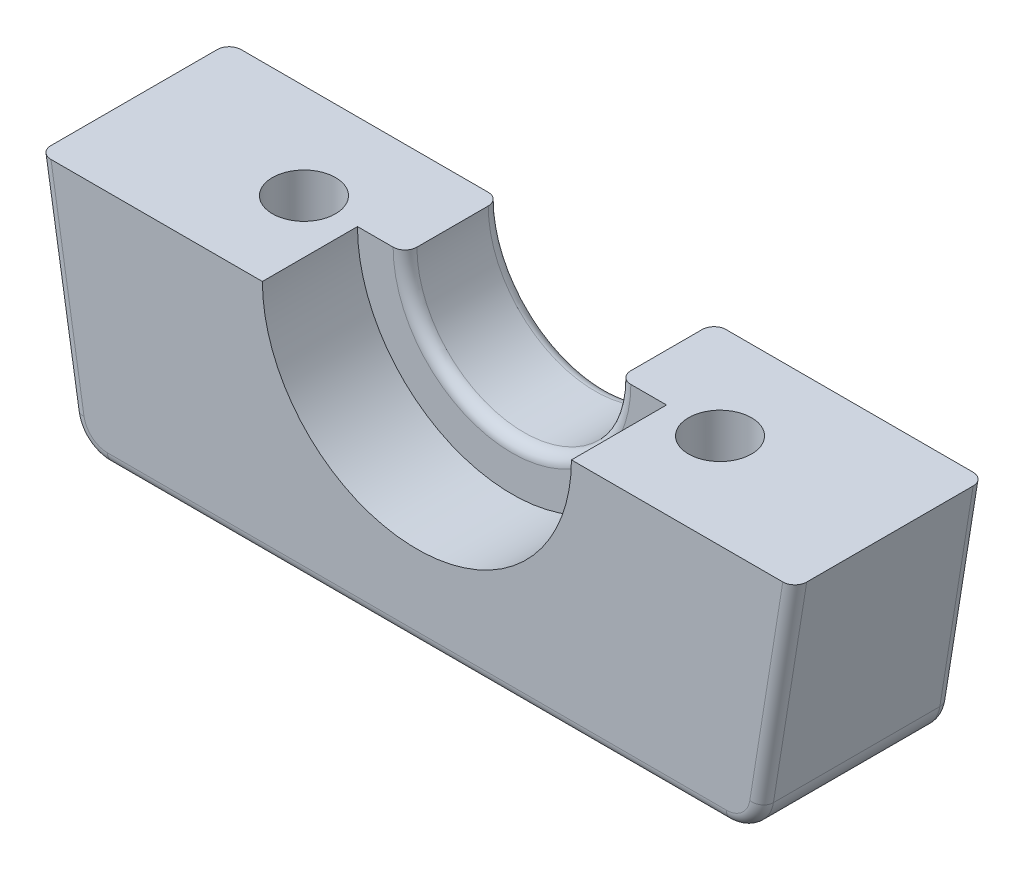
from build123d import *

# Parameters (mm, degrees)
DODANIE_WYCI_GNI_CIE1_DEPTH                       = 8
WYTNIJ_WYCI_GNI_CIE1_DEPTH                        = 8
WYTNIJ_WYCI_GNI_CIE2_DEPTH                        = 39.404607438
WYTNIJ_WYCI_GNI_CIE2_DEPTH_BACK                   = 39.404607438
POG_BIENIE_WALCOWE_POD_M5_RUB_Z_BEM_W_D           = 5.3
POG_BIENIE_WALCOWE_POD_M5_RUB_Z_BEM_W_CBORE_D     = 10
POG_BIENIE_WALCOWE_POD_M5_RUB_Z_BEM_W_CBORE_DEPTH = 5
ZAOKR_GLENIE1_R                                   = 3
ZAOKR_GLENIE2_R                                   = 1


with BuildPart() as part:
    # Szkic1 → Dodanie-wyciągnięcie1 (new, symmetric)
    with BuildSketch(Plane.XY):
        Polygon((0, 0), (28.58974359, 0), (31.794871795, 20), (0, 20), align=None)
    dodanie_wyci_gni_cie1 = extrude(amount=DODANIE_WYCI_GNI_CIE1_DEPTH, both=True)

    # Lustro1: Dodanie-wyciągnięcie1 across plane
    add(dodanie_wyci_gni_cie1.mirror(Plane(origin=(0, 20, 8), x_dir=(0, 0, 1), z_dir=(1, 0, 0))))

    # Szkic2 → Wytnij-wyciągnięcie1 (cut)
    with BuildSketch(Plane.XY.offset(8)):
        with BuildLine():
            Line((-13, 20), (13, 20))
            ThreePointArc((13, 20), (0, 7), (-13, 20))
        make_face()
    extrude(amount=-WYTNIJ_WYCI_GNI_CIE1_DEPTH, mode=Mode.SUBTRACT)

    # Szkic3 → Wytnij-wyciągnięcie2 (cut, two sides: drawn at the far end of the back side and taken through both)
    with BuildSketch(Plane.XY.offset(-WYTNIJ_WYCI_GNI_CIE2_DEPTH_BACK)):
        with BuildLine():
            ThreePointArc((-9, 20), (0, 11), (9, 20))
            Line((9, 20), (-9, 20))
        make_face()
    extrude(amount=WYTNIJ_WYCI_GNI_CIE2_DEPTH + WYTNIJ_WYCI_GNI_CIE2_DEPTH_BACK, mode=Mode.SUBTRACT)

    # Pogłębienie walcowe pod M5 Śrubę z łbem walcowym z gniazdem1 (through all)
    with Locations(Plane(origin=(0, 0, 0), x_dir=(-1, 0, 0), z_dir=(0, -1, 0))):
        with Locations((-17.5, 0), (17.5, 0)):
            CounterBoreHole(POG_BIENIE_WALCOWE_POD_M5_RUB_Z_BEM_W_D / 2, POG_BIENIE_WALCOWE_POD_M5_RUB_Z_BEM_W_CBORE_D / 2, POG_BIENIE_WALCOWE_POD_M5_RUB_Z_BEM_W_CBORE_DEPTH)

    # Zaokrąglenie1
    zaokr_glenie1_edges = [part.edges().sort_by_distance(p)[0] for p in [
        (-28.58974359, 0, 0),
        (28.58974359, 0, 0),
    ]]
    fillet(zaokr_glenie1_edges, radius=ZAOKR_GLENIE1_R)

    # Zaokrąglenie2
    zaokr_glenie2_edges = [part.edges().sort_by_distance(p)[0] for p in [
        (0, 11, 0),
        (0, 11, -8),
        (0, 0, -8),
        (0, 0, 8),
        (30.394654482, 11.262643966, -8),
        (-30.394654482, 11.262643966, -8),
        (27.978494862, 0.717004577, -8),
        (-27.978494862, 0.717004577, -8),
        (-30.394654482, 11.262643966, 8),
        (30.394654482, 11.262643966, 8),
        (27.978494862, 0.717004577, 8),
        (-27.978494862, 0.717004577, 8),
    ]]
    fillet(zaokr_glenie2_edges, radius=ZAOKR_GLENIE2_R)


solid = part.part
